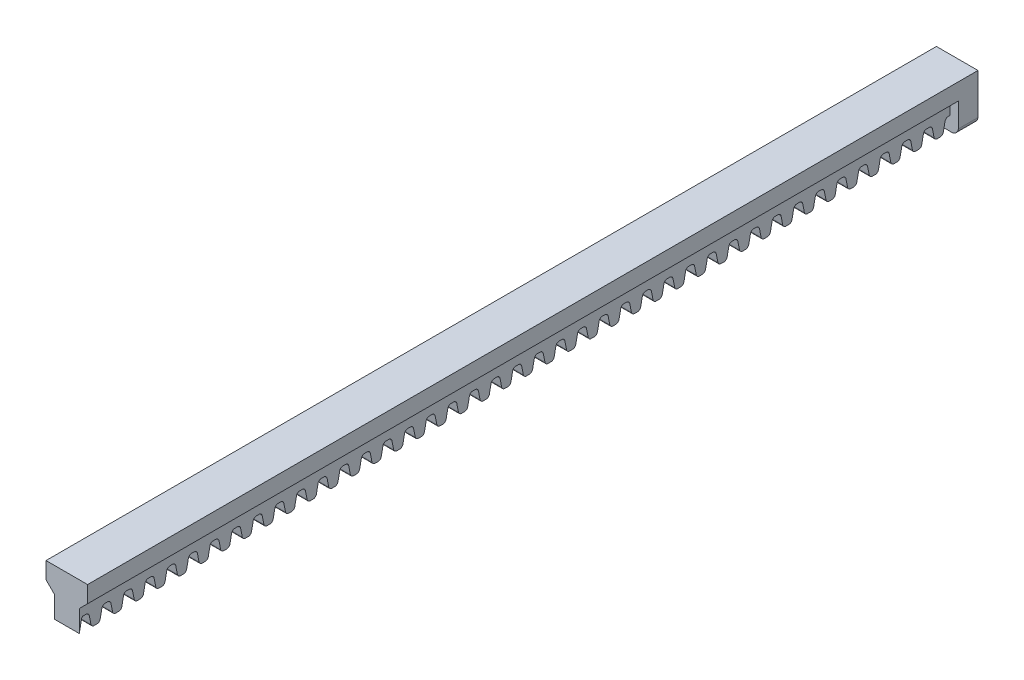
from build123d import *

# Parameters (mm, degrees)
BOSS_EXTRUDE1_DEPTH = 133
BOSS_EXTRUDE2_DEPTH = 3.81
BOSS_EXTRUDE4_DEPTH = 3


with BuildPart() as part:
    # Sketch1 → Boss-Extrude1 (new body)
    with BuildSketch(Plane.XY):
        Polygon((3.175, 2.539999459), (-3.175, 2.539999459), (-3.175, 1.407e-06), (-1.904999134, -1.269999459), (-1.904999134, -2.539999459), (1.905000866, -2.539999459), (1.905000866, -1.269999459), (3.175, -3.24e-07), align=None)
    extrude(amount=BOSS_EXTRUDE1_DEPTH)

    # Sketch2 → Boss-Extrude2 (add)
    with BuildSketch(Plane(origin=(1.905000866, 0, 0), x_dir=(0, 0, -1), z_dir=(1, 0, 0))):
        with BuildLine():
            Line((-4.064881682, -2.948372301), (-4.325343917, -4.250650878))
            ThreePointArc((-4.325343917, -4.250650878), (-4.468915028, -4.51481168), (-4.736685634, -4.651532184))
            Line((-4.736685634, -4.651532184), (-5.240538597, -4.658999528))
            ThreePointArc((-5.240538597, -4.658999528), (-5.562610137, -4.543859094), (-5.738684416, -4.250626687))
            Line((-5.738684416, -4.250626687), (-5.999125028, -2.948381715))
            ThreePointArc((-5.999125028, -2.948381715), (-6.175195708, -2.655144387), (-6.497268154, -2.539999459))
            Line((-6.497268154, -2.539999459), (-3.566740439, -2.539999459))
            ThreePointArc((-3.566740439, -2.539999459), (-3.888809172, -2.655141344), (-4.064881682, -2.948372301))
        make_face()
        with BuildLine():
            Line((-109.728874147, -2.9483723), (-109.989331543, -4.250626687))
            ThreePointArc((-109.989331543, -4.250626687), (-110.132898659, -4.514803071), (-110.400678098, -4.651532184))
            Line((-110.400678098, -4.651532184), (-110.904531062, -4.658999529))
            ThreePointArc((-110.904531062, -4.658999529), (-111.226602601, -4.543859094), (-111.40267688, -4.250626687))
            Line((-111.40267688, -4.250626687), (-111.663119376, -2.9483723))
            ThreePointArc((-111.663119376, -2.9483723), (-111.839191885, -2.655141344), (-112.161260619, -2.539999459))
            Line((-112.161260619, -2.539999459), (-109.230743229, -2.539999459))
            ThreePointArc((-109.230743229, -2.539999459), (-109.55280563, -2.655144617), (-109.728874147, -2.9483723))
        make_face()
        with BuildLine():
            Line((-6.868743777, -2.539999459), (-9.799276068, -2.539999459))
            ThreePointArc((-9.799276068, -2.539999459), (-9.477207334, -2.655141344), (-9.301134825, -2.948372301))
            Line((-9.301134825, -2.948372301), (-9.040677428, -4.250626687))
            ThreePointArc((-9.040677428, -4.250626687), (-8.897102224, -4.514800551), (-8.629321237, -4.651530257))
            Line((-8.629321237, -4.651530257), (-8.125468274, -4.658997601))
            ThreePointArc((-8.125468274, -4.658997601), (-7.803396734, -4.543857167), (-7.627322455, -4.25062476))
            Line((-7.627322455, -4.25062476), (-7.36687996, -2.948370373))
            ThreePointArc((-7.36687996, -2.948370373), (-7.190810843, -2.655139813), (-6.868743777, -2.539999459))
        make_face()
        with BuildLine():
            Line((-10.668867707, -2.9483723), (-10.929325104, -4.250626687))
            ThreePointArc((-10.929325104, -4.250626687), (-11.072900308, -4.514800551), (-11.340681295, -4.651530257))
            Line((-11.340681295, -4.651530257), (-11.844534258, -4.658997601))
            ThreePointArc((-11.844534258, -4.658997601), (-12.166605798, -4.543857167), (-12.342680077, -4.250624759))
            Line((-12.342680077, -4.250624759), (-12.603122572, -2.948370373))
            ThreePointArc((-12.603122572, -2.948370373), (-12.779190154, -2.655141071), (-13.101254785, -2.539999459))
            Line((-13.101254785, -2.539999459), (-10.17073679, -2.539999459))
            ThreePointArc((-10.17073679, -2.539999459), (-10.49279919, -2.655144617), (-10.668867707, -2.9483723))
        make_face()
        with BuildLine():
            Line((-13.472729802, -2.539999459), (-16.403262093, -2.539999459))
            ThreePointArc((-16.403262093, -2.539999459), (-16.081193359, -2.655141344), (-15.90512085, -2.948372301))
            Line((-15.90512085, -2.948372301), (-15.644663453, -4.250626687))
            ThreePointArc((-15.644663453, -4.250626687), (-15.501088249, -4.514800551), (-15.233307262, -4.651530257))
            Line((-15.233307262, -4.651530257), (-14.729454299, -4.658997601))
            ThreePointArc((-14.729454299, -4.658997601), (-14.407382759, -4.543857167), (-14.23130848, -4.25062476))
            Line((-14.23130848, -4.25062476), (-13.970865985, -2.948370373))
            ThreePointArc((-13.970865985, -2.948370373), (-13.794796867, -2.655139813), (-13.472729802, -2.539999459))
        make_face()
        with BuildLine():
            Line((-17.272898436, -2.9483723), (-17.533355832, -4.250626687))
            ThreePointArc((-17.533355832, -4.250626687), (-17.676931036, -4.514800551), (-17.944712023, -4.651530257))
            Line((-17.944712023, -4.651530257), (-18.448564987, -4.658997601))
            ThreePointArc((-18.448564987, -4.658997601), (-18.770636526, -4.543857167), (-18.946710805, -4.250624759))
            Line((-18.946710805, -4.250624759), (-19.207153301, -2.948370373))
            ThreePointArc((-19.207153301, -2.948370373), (-19.383220883, -2.655141071), (-19.705285514, -2.539999459))
            Line((-19.705285514, -2.539999459), (-16.774767518, -2.539999459))
            ThreePointArc((-16.774767518, -2.539999459), (-17.096829918, -2.655144617), (-17.272898436, -2.9483723))
        make_face()
        with BuildLine():
            Line((-20.07676053, -2.539999459), (-23.007292821, -2.539999459))
            ThreePointArc((-23.007292821, -2.539999459), (-22.685224088, -2.655141344), (-22.509151578, -2.948372301))
            Line((-22.509151578, -2.948372301), (-22.248694181, -4.250626687))
            ThreePointArc((-22.248694181, -4.250626687), (-22.105118977, -4.514800551), (-21.83733799, -4.651530257))
            Line((-21.83733799, -4.651530257), (-21.333485027, -4.658997601))
            ThreePointArc((-21.333485027, -4.658997601), (-21.011413487, -4.543857167), (-20.835339208, -4.25062476))
            Line((-20.835339208, -4.25062476), (-20.574896713, -2.948370373))
            ThreePointArc((-20.574896713, -2.948370373), (-20.398827596, -2.655139813), (-20.07676053, -2.539999459))
        make_face()
        with BuildLine():
            Line((-23.87688446, -2.9483723), (-24.137341857, -4.250626687))
            ThreePointArc((-24.137341857, -4.250626687), (-24.280917061, -4.514800551), (-24.548698048, -4.651530257))
            Line((-24.548698048, -4.651530257), (-25.052551011, -4.658997601))
            ThreePointArc((-25.052551011, -4.658997601), (-25.374622551, -4.543857167), (-25.55069683, -4.250624759))
            Line((-25.55069683, -4.250624759), (-25.811139326, -2.948370373))
            ThreePointArc((-25.811139326, -2.948370373), (-25.987206908, -2.655141071), (-26.309271538, -2.539999459))
            Line((-26.309271538, -2.539999459), (-23.378753543, -2.539999459))
            ThreePointArc((-23.378753543, -2.539999459), (-23.700815943, -2.655144617), (-23.87688446, -2.9483723))
        make_face()
        with BuildLine():
            Line((-26.680746555, -2.539999459), (-29.611278846, -2.539999459))
            ThreePointArc((-29.611278846, -2.539999459), (-29.289210112, -2.655141344), (-29.113137603, -2.948372301))
            Line((-29.113137603, -2.948372301), (-28.852680206, -4.250626687))
            ThreePointArc((-28.852680206, -4.250626687), (-28.709113091, -4.514803071), (-28.441333652, -4.651532184))
            Line((-28.441333652, -4.651532184), (-27.937480688, -4.658999529))
            ThreePointArc((-27.937480688, -4.658999529), (-27.615409148, -4.543859094), (-27.439334869, -4.250626687))
            Line((-27.439334869, -4.250626687), (-27.178892374, -2.948372301))
            ThreePointArc((-27.178892374, -2.948372301), (-27.002818095, -2.655139893), (-26.680746555, -2.539999459))
        make_face()
        with BuildLine():
            Line((-30.480877936, -2.9483723), (-30.741335332, -4.250626687))
            ThreePointArc((-30.741335332, -4.250626687), (-30.884902448, -4.514803071), (-31.152681887, -4.651532184))
            Line((-31.152681887, -4.651532184), (-31.656534851, -4.658999529))
            ThreePointArc((-31.656534851, -4.658999529), (-31.97860639, -4.543859094), (-32.154680669, -4.250626687))
            Line((-32.154680669, -4.250626687), (-32.415123165, -2.9483723))
            ThreePointArc((-32.415123165, -2.9483723), (-32.591195674, -2.655141344), (-32.913264407, -2.539999459))
            Line((-32.913264407, -2.539999459), (-29.982747018, -2.539999459))
            ThreePointArc((-29.982747018, -2.539999459), (-30.304809419, -2.655144617), (-30.480877936, -2.9483723))
        make_face()
        with BuildLine():
            Line((-33.284740031, -2.539999459), (-36.215272321, -2.539999459))
            ThreePointArc((-36.215272321, -2.539999459), (-35.893203588, -2.655141344), (-35.717131078, -2.948372301))
            Line((-35.717131078, -2.948372301), (-35.456673682, -4.250626687))
            ThreePointArc((-35.456673682, -4.250626687), (-35.313098478, -4.514800551), (-35.045317491, -4.651530257))
            Line((-35.045317491, -4.651530257), (-34.541464527, -4.658997601))
            ThreePointArc((-34.541464527, -4.658997601), (-34.219392987, -4.543857167), (-34.043318709, -4.25062476))
            Line((-34.043318709, -4.25062476), (-33.782876213, -2.948370373))
            ThreePointArc((-33.782876213, -2.948370373), (-33.606807096, -2.655139813), (-33.284740031, -2.539999459))
        make_face()
        with BuildLine():
            Line((-37.084863961, -2.9483723), (-37.345321357, -4.250626687))
            ThreePointArc((-37.345321357, -4.250626687), (-37.488896561, -4.514800551), (-37.756677548, -4.651530257))
            Line((-37.756677548, -4.651530257), (-38.260530512, -4.658997601))
            ThreePointArc((-38.260530512, -4.658997601), (-38.582602052, -4.543857167), (-38.75867633, -4.250624759))
            Line((-38.75867633, -4.250624759), (-39.019118826, -2.948370373))
            ThreePointArc((-39.019118826, -2.948370373), (-39.195186408, -2.655141071), (-39.517251039, -2.539999459))
            Line((-39.517251039, -2.539999459), (-36.586733043, -2.539999459))
            ThreePointArc((-36.586733043, -2.539999459), (-36.908795444, -2.655144617), (-37.084863961, -2.9483723))
        make_face()
        with BuildLine():
            Line((-39.888726056, -2.539999459), (-42.819258346, -2.539999459))
            ThreePointArc((-42.819258346, -2.539999459), (-42.497189613, -2.655141344), (-42.321117103, -2.948372301))
            Line((-42.321117103, -2.948372301), (-42.060659707, -4.250626687))
            ThreePointArc((-42.060659707, -4.250626687), (-41.917084502, -4.514800551), (-41.649303516, -4.651530257))
            Line((-41.649303516, -4.651530257), (-41.145450552, -4.658997601))
            ThreePointArc((-41.145450552, -4.658997601), (-40.823379012, -4.543857167), (-40.647304733, -4.25062476))
            Line((-40.647304733, -4.25062476), (-40.386862238, -2.948370373))
            ThreePointArc((-40.386862238, -2.948370373), (-40.210793121, -2.655139813), (-39.888726056, -2.539999459))
        make_face()
        with BuildLine():
            Line((-43.688894689, -2.9483723), (-43.949352086, -4.250626687))
            ThreePointArc((-43.949352086, -4.250626687), (-44.09292729, -4.514800551), (-44.360708277, -4.651530257))
            Line((-44.360708277, -4.651530257), (-44.86456124, -4.658997601))
            ThreePointArc((-44.86456124, -4.658997601), (-45.18663278, -4.543857167), (-45.362707059, -4.250624759))
            Line((-45.362707059, -4.250624759), (-45.623149554, -2.948370373))
            ThreePointArc((-45.623149554, -2.948370373), (-45.799217136, -2.655141071), (-46.121281767, -2.539999459))
            Line((-46.121281767, -2.539999459), (-43.190763772, -2.539999459))
            ThreePointArc((-43.190763772, -2.539999459), (-43.512826172, -2.655144617), (-43.688894689, -2.9483723))
        make_face()
        with BuildLine():
            Line((-46.492756784, -2.539999459), (-49.423289074, -2.539999459))
            ThreePointArc((-49.423289074, -2.539999459), (-49.101220341, -2.655141344), (-48.925147831, -2.948372301))
            Line((-48.925147831, -2.948372301), (-48.664690435, -4.250626687))
            ThreePointArc((-48.664690435, -4.250626687), (-48.521115231, -4.514800551), (-48.253334244, -4.651530257))
            Line((-48.253334244, -4.651530257), (-47.74948128, -4.658997601))
            ThreePointArc((-47.74948128, -4.658997601), (-47.427409741, -4.543857167), (-47.251335462, -4.25062476))
            Line((-47.251335462, -4.25062476), (-46.990892966, -2.948370373))
            ThreePointArc((-46.990892966, -2.948370373), (-46.814823849, -2.655139813), (-46.492756784, -2.539999459))
        make_face()
        with BuildLine():
            Line((-50.292880714, -2.9483723), (-50.55333811, -4.250626687))
            ThreePointArc((-50.55333811, -4.250626687), (-50.696913315, -4.514800551), (-50.964694302, -4.651530257))
            Line((-50.964694302, -4.651530257), (-51.468547265, -4.658997601))
            ThreePointArc((-51.468547265, -4.658997601), (-51.790618805, -4.543857167), (-51.966693084, -4.250624759))
            Line((-51.966693084, -4.250624759), (-52.227135579, -2.948370373))
            ThreePointArc((-52.227135579, -2.948370373), (-52.403203161, -2.655141071), (-52.725267792, -2.539999459))
            Line((-52.725267792, -2.539999459), (-49.794749796, -2.539999459))
            ThreePointArc((-49.794749796, -2.539999459), (-50.116812197, -2.655144617), (-50.292880714, -2.9483723))
        make_face()
        with BuildLine():
            Line((-53.096742809, -2.539999459), (-56.027275099, -2.539999459))
            ThreePointArc((-56.027275099, -2.539999459), (-55.705206366, -2.655141344), (-55.529133856, -2.948372301))
            Line((-55.529133856, -2.948372301), (-55.26867646, -4.250626687))
            ThreePointArc((-55.26867646, -4.250626687), (-55.125109344, -4.514803071), (-54.857329905, -4.651532184))
            Line((-54.857329905, -4.651532184), (-54.353476942, -4.658999529))
            ThreePointArc((-54.353476942, -4.658999529), (-54.031405402, -4.543859094), (-53.855331123, -4.250626687))
            Line((-53.855331123, -4.250626687), (-53.594888628, -2.948372301))
            ThreePointArc((-53.594888628, -2.948372301), (-53.418814349, -2.655139893), (-53.096742809, -2.539999459))
        make_face()
        with BuildLine():
            Line((-56.896874189, -2.9483723), (-57.157331586, -4.250626687))
            ThreePointArc((-57.157331586, -4.250626687), (-57.300898701, -4.514803071), (-57.568678141, -4.651532184))
            Line((-57.568678141, -4.651532184), (-58.072531104, -4.658999529))
            ThreePointArc((-58.072531104, -4.658999529), (-58.394602644, -4.543859094), (-58.570676923, -4.250626687))
            Line((-58.570676923, -4.250626687), (-58.831119418, -2.9483723))
            ThreePointArc((-58.831119418, -2.9483723), (-59.007191928, -2.655141344), (-59.329260661, -2.539999459))
            Line((-59.329260661, -2.539999459), (-56.398743272, -2.539999459))
            ThreePointArc((-56.398743272, -2.539999459), (-56.720805672, -2.655144617), (-56.896874189, -2.9483723))
        make_face()
        with BuildLine():
            Line((-59.700736284, -2.539999459), (-62.631268575, -2.539999459))
            ThreePointArc((-62.631268575, -2.539999459), (-62.309199841, -2.655141344), (-62.133127332, -2.948372301))
            Line((-62.133127332, -2.948372301), (-61.872669935, -4.250626687))
            ThreePointArc((-61.872669935, -4.250626687), (-61.729094731, -4.514800551), (-61.461313744, -4.651530257))
            Line((-61.461313744, -4.651530257), (-60.957460781, -4.658997601))
            ThreePointArc((-60.957460781, -4.658997601), (-60.635389241, -4.543857167), (-60.459314962, -4.25062476))
            Line((-60.459314962, -4.25062476), (-60.198872467, -2.948370373))
            ThreePointArc((-60.198872467, -2.948370373), (-60.02280335, -2.655139813), (-59.700736284, -2.539999459))
        make_face()
        with BuildLine():
            Line((-63.500860214, -2.9483723), (-63.761317611, -4.250626687))
            ThreePointArc((-63.761317611, -4.250626687), (-63.904892815, -4.514800551), (-64.172673802, -4.651530257))
            Line((-64.172673802, -4.651530257), (-64.676526765, -4.658997601))
            ThreePointArc((-64.676526765, -4.658997601), (-64.998598305, -4.543857167), (-65.174672584, -4.250624759))
            Line((-65.174672584, -4.250624759), (-65.435115079, -2.948370373))
            ThreePointArc((-65.435115079, -2.948370373), (-65.611182661, -2.655141071), (-65.933247292, -2.539999459))
            Line((-65.933247292, -2.539999459), (-63.002729297, -2.539999459))
            ThreePointArc((-63.002729297, -2.539999459), (-63.324791697, -2.655144617), (-63.500860214, -2.9483723))
        make_face()
        with BuildLine():
            Line((-66.304722309, -2.539999459), (-69.2352546, -2.539999459))
            ThreePointArc((-69.2352546, -2.539999459), (-68.913185866, -2.655141344), (-68.737113357, -2.948372301))
            Line((-68.737113357, -2.948372301), (-68.47665596, -4.250626687))
            ThreePointArc((-68.47665596, -4.250626687), (-68.333080756, -4.514800551), (-68.065299769, -4.651530257))
            Line((-68.065299769, -4.651530257), (-67.561446806, -4.658997601))
            ThreePointArc((-67.561446806, -4.658997601), (-67.239375266, -4.543857167), (-67.063300987, -4.25062476))
            Line((-67.063300987, -4.25062476), (-66.802858492, -2.948370373))
            ThreePointArc((-66.802858492, -2.948370373), (-66.626789374, -2.655139813), (-66.304722309, -2.539999459))
        make_face()
        with BuildLine():
            Line((-70.104890943, -2.9483723), (-70.365348339, -4.250626687))
            ThreePointArc((-70.365348339, -4.250626687), (-70.508923543, -4.514800551), (-70.77670453, -4.651530257))
            Line((-70.77670453, -4.651530257), (-71.280557494, -4.658997601))
            ThreePointArc((-71.280557494, -4.658997601), (-71.602629033, -4.543857167), (-71.778703312, -4.250624759))
            Line((-71.778703312, -4.250624759), (-72.039145808, -2.948370373))
            ThreePointArc((-72.039145808, -2.948370373), (-72.21521339, -2.655141071), (-72.53727802, -2.539999459))
            Line((-72.53727802, -2.539999459), (-69.606760025, -2.539999459))
            ThreePointArc((-69.606760025, -2.539999459), (-69.928822425, -2.655144617), (-70.104890943, -2.9483723))
        make_face()
        with BuildLine():
            Line((-72.908753037, -2.539999459), (-75.839285328, -2.539999459))
            ThreePointArc((-75.839285328, -2.539999459), (-75.517216595, -2.655141344), (-75.341144085, -2.948372301))
            Line((-75.341144085, -2.948372301), (-75.080686688, -4.250626687))
            ThreePointArc((-75.080686688, -4.250626687), (-74.937111484, -4.514800551), (-74.669330497, -4.651530257))
            Line((-74.669330497, -4.651530257), (-74.165477534, -4.658997601))
            ThreePointArc((-74.165477534, -4.658997601), (-73.843405994, -4.543857167), (-73.667331715, -4.25062476))
            Line((-73.667331715, -4.25062476), (-73.40688922, -2.948370373))
            ThreePointArc((-73.40688922, -2.948370373), (-73.230820103, -2.655139813), (-72.908753037, -2.539999459))
        make_face()
        with BuildLine():
            Line((-76.708876967, -2.9483723), (-76.969334364, -4.250626687))
            ThreePointArc((-76.969334364, -4.250626687), (-77.112909568, -4.514800551), (-77.380690555, -4.651530257))
            Line((-77.380690555, -4.651530257), (-77.884543518, -4.658997601))
            ThreePointArc((-77.884543518, -4.658997601), (-78.206615058, -4.543857167), (-78.382689337, -4.250624759))
            Line((-78.382689337, -4.250624759), (-78.643131833, -2.948370373))
            ThreePointArc((-78.643131833, -2.948370373), (-78.819199415, -2.655141071), (-79.141264045, -2.539999459))
            Line((-79.141264045, -2.539999459), (-76.21074605, -2.539999459))
            ThreePointArc((-76.21074605, -2.539999459), (-76.53280845, -2.655144617), (-76.708876967, -2.9483723))
        make_face()
        with BuildLine():
            Line((-79.512739062, -2.539999459), (-82.443271353, -2.539999459))
            ThreePointArc((-82.443271353, -2.539999459), (-82.121202619, -2.655141344), (-81.94513011, -2.948372301))
            Line((-81.94513011, -2.948372301), (-81.684672713, -4.250626687))
            ThreePointArc((-81.684672713, -4.250626687), (-81.541105598, -4.514803071), (-81.273326159, -4.651532184))
            Line((-81.273326159, -4.651532184), (-80.769473195, -4.658999529))
            ThreePointArc((-80.769473195, -4.658999529), (-80.447401655, -4.543859094), (-80.271327376, -4.250626687))
            Line((-80.271327376, -4.250626687), (-80.010884881, -2.948372301))
            ThreePointArc((-80.010884881, -2.948372301), (-79.834810602, -2.655139893), (-79.512739062, -2.539999459))
        make_face()
        with BuildLine():
            Line((-83.312870443, -2.9483723), (-83.573327839, -4.250626687))
            ThreePointArc((-83.573327839, -4.250626687), (-83.716894955, -4.514803071), (-83.984674394, -4.651532184))
            Line((-83.984674394, -4.651532184), (-84.488527358, -4.658999529))
            ThreePointArc((-84.488527358, -4.658999529), (-84.810598897, -4.543859094), (-84.986673176, -4.250626687))
            Line((-84.986673176, -4.250626687), (-85.247115672, -2.9483723))
            ThreePointArc((-85.247115672, -2.9483723), (-85.423188181, -2.655141344), (-85.745256914, -2.539999459))
            Line((-85.745256914, -2.539999459), (-82.814739525, -2.539999459))
            ThreePointArc((-82.814739525, -2.539999459), (-83.136801926, -2.655144617), (-83.312870443, -2.9483723))
        make_face()
        with BuildLine():
            Line((-86.116732538, -2.539999459), (-89.047264828, -2.539999459))
            ThreePointArc((-89.047264828, -2.539999459), (-88.725196095, -2.655141344), (-88.549123585, -2.948372301))
            Line((-88.549123585, -2.948372301), (-88.288666189, -4.250626687))
            ThreePointArc((-88.288666189, -4.250626687), (-88.145090985, -4.514800551), (-87.877309998, -4.651530257))
            Line((-87.877309998, -4.651530257), (-87.373457034, -4.658997601))
            ThreePointArc((-87.373457034, -4.658997601), (-87.051385494, -4.543857167), (-86.875311215, -4.25062476))
            Line((-86.875311215, -4.25062476), (-86.61486872, -2.948370373))
            ThreePointArc((-86.61486872, -2.948370373), (-86.438799603, -2.655139813), (-86.116732538, -2.539999459))
        make_face()
        with BuildLine():
            Line((-89.916856468, -2.9483723), (-90.177313864, -4.250626687))
            ThreePointArc((-90.177313864, -4.250626687), (-90.320889068, -4.514800551), (-90.588670055, -4.651530257))
            Line((-90.588670055, -4.651530257), (-91.092523019, -4.658997601))
            ThreePointArc((-91.092523019, -4.658997601), (-91.414594558, -4.543857167), (-91.590668837, -4.250624759))
            Line((-91.590668837, -4.250624759), (-91.851111333, -2.948370373))
            ThreePointArc((-91.851111333, -2.948370373), (-92.027178915, -2.655141071), (-92.349243546, -2.539999459))
            Line((-92.349243546, -2.539999459), (-89.41872555, -2.539999459))
            ThreePointArc((-89.41872555, -2.539999459), (-89.740787951, -2.655144617), (-89.916856468, -2.9483723))
        make_face()
        with BuildLine():
            Line((-92.720718563, -2.539999459), (-95.651250853, -2.539999459))
            ThreePointArc((-95.651250853, -2.539999459), (-95.32918212, -2.655141344), (-95.15310961, -2.948372301))
            Line((-95.15310961, -2.948372301), (-94.892652214, -4.250626687))
            ThreePointArc((-94.892652214, -4.250626687), (-94.749077009, -4.514800551), (-94.481296023, -4.651530257))
            Line((-94.481296023, -4.651530257), (-93.977443059, -4.658997601))
            ThreePointArc((-93.977443059, -4.658997601), (-93.655371519, -4.543857167), (-93.47929724, -4.25062476))
            Line((-93.47929724, -4.25062476), (-93.218854745, -2.948370373))
            ThreePointArc((-93.218854745, -2.948370373), (-93.042785628, -2.655139813), (-92.720718563, -2.539999459))
        make_face()
        with BuildLine():
            Line((-96.520887196, -2.9483723), (-96.781344593, -4.250626687))
            ThreePointArc((-96.781344593, -4.250626687), (-96.924919797, -4.514800551), (-97.192700784, -4.651530257))
            Line((-97.192700784, -4.651530257), (-97.696553747, -4.658997601))
            ThreePointArc((-97.696553747, -4.658997601), (-98.018625287, -4.543857167), (-98.194699566, -4.250624759))
            Line((-98.194699566, -4.250624759), (-98.455142061, -2.948370373))
            ThreePointArc((-98.455142061, -2.948370373), (-98.631209643, -2.655141071), (-98.953274274, -2.539999459))
            Line((-98.953274274, -2.539999459), (-96.022756279, -2.539999459))
            ThreePointArc((-96.022756279, -2.539999459), (-96.344818679, -2.655144617), (-96.520887196, -2.9483723))
        make_face()
        with BuildLine():
            Line((-99.324749291, -2.539999459), (-102.255281581, -2.539999459))
            ThreePointArc((-102.255281581, -2.539999459), (-101.933212848, -2.655141344), (-101.757140338, -2.948372301))
            Line((-101.757140338, -2.948372301), (-101.496682942, -4.250626687))
            ThreePointArc((-101.496682942, -4.250626687), (-101.353107738, -4.514800551), (-101.085326751, -4.651530257))
            Line((-101.085326751, -4.651530257), (-100.581473787, -4.658997601))
            ThreePointArc((-100.581473787, -4.658997601), (-100.259402248, -4.543857167), (-100.083327969, -4.25062476))
            Line((-100.083327969, -4.25062476), (-99.822885473, -2.948370373))
            ThreePointArc((-99.822885473, -2.948370373), (-99.646816356, -2.655139813), (-99.324749291, -2.539999459))
        make_face()
        with BuildLine():
            Line((-103.124873221, -2.9483723), (-103.385330617, -4.250626687))
            ThreePointArc((-103.385330617, -4.250626687), (-103.528905822, -4.514800551), (-103.796686808, -4.651530257))
            Line((-103.796686808, -4.651530257), (-104.300539772, -4.658997601))
            ThreePointArc((-104.300539772, -4.658997601), (-104.622611312, -4.543857167), (-104.798685591, -4.250624759))
            Line((-104.798685591, -4.250624759), (-105.059128086, -2.948370373))
            ThreePointArc((-105.059128086, -2.948370373), (-105.235195668, -2.655141071), (-105.557260299, -2.539999459))
            Line((-105.557260299, -2.539999459), (-102.626742303, -2.539999459))
            ThreePointArc((-102.626742303, -2.539999459), (-102.948804704, -2.655144617), (-103.124873221, -2.9483723))
        make_face()
        with BuildLine():
            Line((-105.928735316, -2.539999459), (-108.859267606, -2.539999459))
            ThreePointArc((-108.859267606, -2.539999459), (-108.537198873, -2.655141344), (-108.361126363, -2.948372301))
            Line((-108.361126363, -2.948372301), (-108.100668967, -4.250626687))
            ThreePointArc((-108.100668967, -4.250626687), (-107.957101851, -4.514803071), (-107.689322412, -4.651532184))
            Line((-107.689322412, -4.651532184), (-107.185469449, -4.658999529))
            ThreePointArc((-107.185469449, -4.658999529), (-106.863397909, -4.543859094), (-106.68732363, -4.250626687))
            Line((-106.68732363, -4.250626687), (-106.426881135, -2.948372301))
            ThreePointArc((-106.426881135, -2.948372301), (-106.250806856, -2.655139893), (-105.928735316, -2.539999459))
        make_face()
        with BuildLine():
            Line((-112.532736242, -2.539999459), (-115.463268532, -2.539999459))
            ThreePointArc((-115.463268532, -2.539999459), (-115.141199799, -2.655141344), (-114.965127289, -2.948372301))
            Line((-114.965127289, -2.948372301), (-114.704669893, -4.250626687))
            ThreePointArc((-114.704669893, -4.250626687), (-114.561094689, -4.514800551), (-114.293313702, -4.651530257))
            Line((-114.293313702, -4.651530257), (-113.789460738, -4.658997601))
            ThreePointArc((-113.789460738, -4.658997601), (-113.467389199, -4.543857167), (-113.29131492, -4.25062476))
            Line((-113.29131492, -4.25062476), (-113.030872424, -2.948370373))
            ThreePointArc((-113.030872424, -2.948370373), (-112.854803307, -2.655139813), (-112.532736242, -2.539999459))
        make_face()
        with BuildLine():
            Line((-116.332860172, -2.9483723), (-116.593317568, -4.250626687))
            ThreePointArc((-116.593317568, -4.250626687), (-116.736892772, -4.514800551), (-117.004673759, -4.651530257))
            Line((-117.004673759, -4.651530257), (-117.508526723, -4.658997601))
            ThreePointArc((-117.508526723, -4.658997601), (-117.830598263, -4.543857167), (-118.006672542, -4.250624759))
            Line((-118.006672542, -4.250624759), (-118.267115037, -2.948370373))
            ThreePointArc((-118.267115037, -2.948370373), (-118.443182619, -2.655141071), (-118.76524725, -2.539999459))
            Line((-118.76524725, -2.539999459), (-115.834729254, -2.539999459))
            ThreePointArc((-115.834729254, -2.539999459), (-116.156791655, -2.655144617), (-116.332860172, -2.9483723))
        make_face()
        with BuildLine():
            Line((-119.136722267, -2.539999459), (-122.067254557, -2.539999459))
            ThreePointArc((-122.067254557, -2.539999459), (-121.745185824, -2.655141344), (-121.569113314, -2.948372301))
            Line((-121.569113314, -2.948372301), (-121.308655918, -4.250626687))
            ThreePointArc((-121.308655918, -4.250626687), (-121.165080714, -4.514800551), (-120.897299727, -4.651530257))
            Line((-120.897299727, -4.651530257), (-120.393446763, -4.658997601))
            ThreePointArc((-120.393446763, -4.658997601), (-120.071375223, -4.543857167), (-119.895300944, -4.25062476))
            Line((-119.895300944, -4.25062476), (-119.634858449, -2.948370373))
            ThreePointArc((-119.634858449, -2.948370373), (-119.458789332, -2.655139813), (-119.136722267, -2.539999459))
        make_face()
        with BuildLine():
            Line((-122.9368909, -2.9483723), (-123.197348297, -4.250626687))
            ThreePointArc((-123.197348297, -4.250626687), (-123.340923501, -4.514800551), (-123.608704488, -4.651530257))
            Line((-123.608704488, -4.651530257), (-124.112557451, -4.658997601))
            ThreePointArc((-124.112557451, -4.658997601), (-124.434628991, -4.543857167), (-124.61070327, -4.250624759))
            Line((-124.61070327, -4.250624759), (-124.871145765, -2.948370373))
            ThreePointArc((-124.871145765, -2.948370373), (-125.047213347, -2.655141071), (-125.369277978, -2.539999459))
            Line((-125.369277978, -2.539999459), (-122.438759983, -2.539999459))
            ThreePointArc((-122.438759983, -2.539999459), (-122.760822383, -2.655144617), (-122.9368909, -2.9483723))
        make_face()
        with BuildLine():
            Line((-125.740752995, -2.539999459), (-128.671285285, -2.539999459))
            ThreePointArc((-128.671285285, -2.539999459), (-128.349216552, -2.655141344), (-128.173144042, -2.948372301))
            Line((-128.173144042, -2.948372301), (-127.912686646, -4.250626687))
            ThreePointArc((-127.912686646, -4.250626687), (-127.769111442, -4.514800551), (-127.501330455, -4.651530257))
            Line((-127.501330455, -4.651530257), (-126.997477491, -4.658997601))
            ThreePointArc((-126.997477491, -4.658997601), (-126.675405952, -4.543857167), (-126.499331673, -4.25062476))
            Line((-126.499331673, -4.25062476), (-126.238889177, -2.948370373))
            ThreePointArc((-126.238889177, -2.948370373), (-126.06282006, -2.655139813), (-125.740752995, -2.539999459))
        make_face()
        with BuildLine():
            Line((-129.540876925, -2.9483723), (-129.801334321, -4.250626687))
            ThreePointArc((-129.801334321, -4.250626687), (-129.944909526, -4.514800551), (-130.212690513, -4.651530257))
            Line((-130.212690513, -4.651530257), (-130.716543476, -4.658997601))
            ThreePointArc((-130.716543476, -4.658997601), (-131.038615016, -4.543857167), (-131.214689295, -4.250624759))
            Line((-131.214689295, -4.250624759), (-131.47513179, -2.948370373))
            ThreePointArc((-131.47513179, -2.948370373), (-131.651199372, -2.655141071), (-131.973264003, -2.539999459))
            Line((-131.973264003, -2.539999459), (-129.042735682, -2.539999459))
            ThreePointArc((-129.042735682, -2.539999459), (-129.364804415, -2.655141344), (-129.540876925, -2.9483723))
        make_face()
        with BuildLine():
            Line((-133, -2.539999459), (-133, -4.578365581))
            Line((-133, -4.578365581), (-132.634120552, -2.748961799))
            ThreePointArc((-132.634120552, -2.748961799), (-132.544027265, -2.598917126), (-132.379227652, -2.539999459))
            Line((-132.379227652, -2.539999459), (-133, -2.539999459))
        make_face()
        with BuildLine():
            Line((-0.26509178, -2.539999459), (-3.195619496, -2.539999459))
            ThreePointArc((-3.195619496, -2.539999459), (-2.873550762, -2.655141344), (-2.697478253, -2.948372301))
            Line((-2.697478253, -2.948372301), (-2.437016018, -4.250650878))
            ThreePointArc((-2.437016018, -4.250650878), (-2.293444906, -4.51481168), (-2.025674301, -4.651532184))
            Line((-2.025674301, -4.651532184), (-1.521821337, -4.658999528))
            ThreePointArc((-1.521821337, -4.658999528), (-1.199749798, -4.543859094), (-1.023675519, -4.250626687))
            Line((-1.023675519, -4.250626687), (-0.763234906, -2.948381715))
            ThreePointArc((-0.763234906, -2.948381715), (-0.587164226, -2.655144387), (-0.26509178, -2.539999459))
        make_face()
    extrude(amount=-BOSS_EXTRUDE2_DEPTH)

    # Sketch3 → Boss-Extrude4 (add)
    with BuildSketch(Plane(origin=(0, 0, 0), x_dir=(-1, 0, 0), z_dir=(0, 0, -1))):
        with BuildLine():
            Line((-3.175, 2.539999459), (-3.175, -3.683666236))
            ThreePointArc((-3.175, -3.683666236), (-2.741998572, -4.434358315), (-1.905000866, -4.658999528))
            Line((-1.905000866, -4.658999528), (-1.905000866, -4.651532184))
            Line((-1.905000866, -4.651532184), (1.904999134, -4.651532184))
            Line((1.904999134, -4.651532184), (1.904999134, -4.658999528))
            ThreePointArc((1.904999134, -4.658999528), (2.741997706, -4.434358674), (3.175, -3.683666236))
            Line((3.175, -3.683666236), (3.175, 2.539999459))
            Line((3.175, 2.539999459), (-3.175, 2.539999459))
        make_face()
    extrude(amount=BOSS_EXTRUDE4_DEPTH)


solid = part.part
